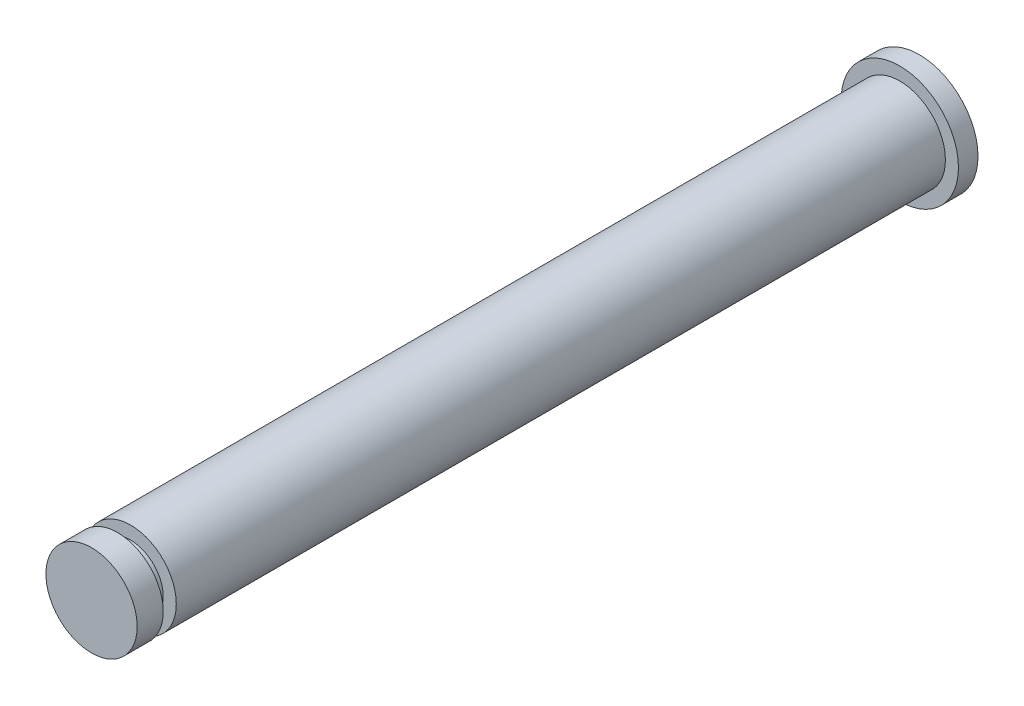
from build123d import *


with BuildPart() as part:
    # 草图2 → 旋转1 (revolve)
    with BuildSketch(Plane(origin=(0, 0, 0), x_dir=(0, 0, -1), z_dir=(1, 0, 0)), mode=Mode.PRIVATE) as revolve_1_sk:
        Polygon((0, 0), (0, 3.5), (2, 3.5), (2, 2.5), (3, 2.5), (3, 3.5), (62, 3.5), (62, 4.5), (63.5, 4.5), (63.5, 0), align=None)
    revolve(revolve_1_sk.sketch.rotate(Axis((0, 0, 0), (0, 0, -1)), 90), axis=Axis((0, 0, 0), (0, 0, -1)))


solid = part.part
